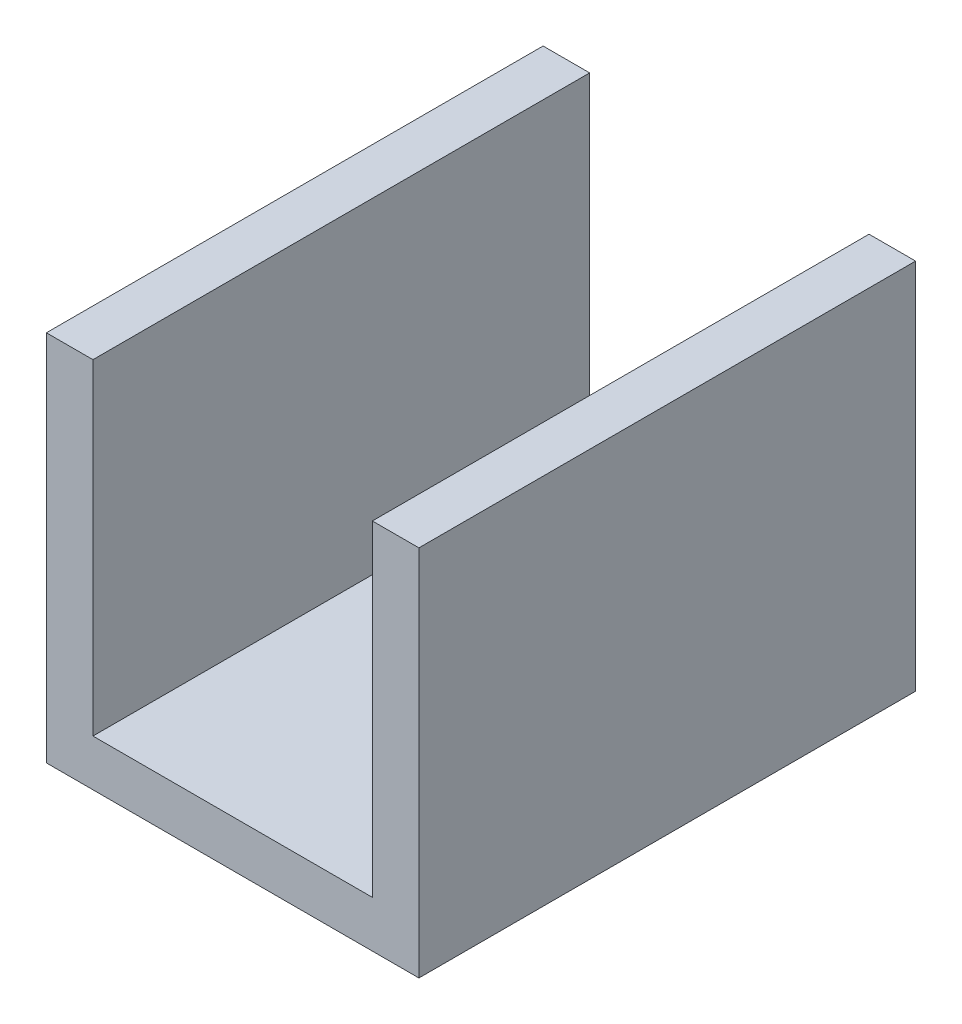
from build123d import *

# Parameters (mm, degrees)
BOSS_EXTRUDE1_DEPTH = 12.7


with BuildPart() as part:
    # Sketch1 → Boss-Extrude1 (new, symmetric)
    with BuildSketch(Plane.XY):
        Polygon((-7.14375, 19.05), (-9.525, 19.05), (-9.525, 0), (9.525, 0), (9.525, 19.05), (7.14375, 19.05), (7.14375, 2.38125), (-7.14375, 2.38125), align=None)
    extrude(amount=BOSS_EXTRUDE1_DEPTH, both=True)


solid = part.part
